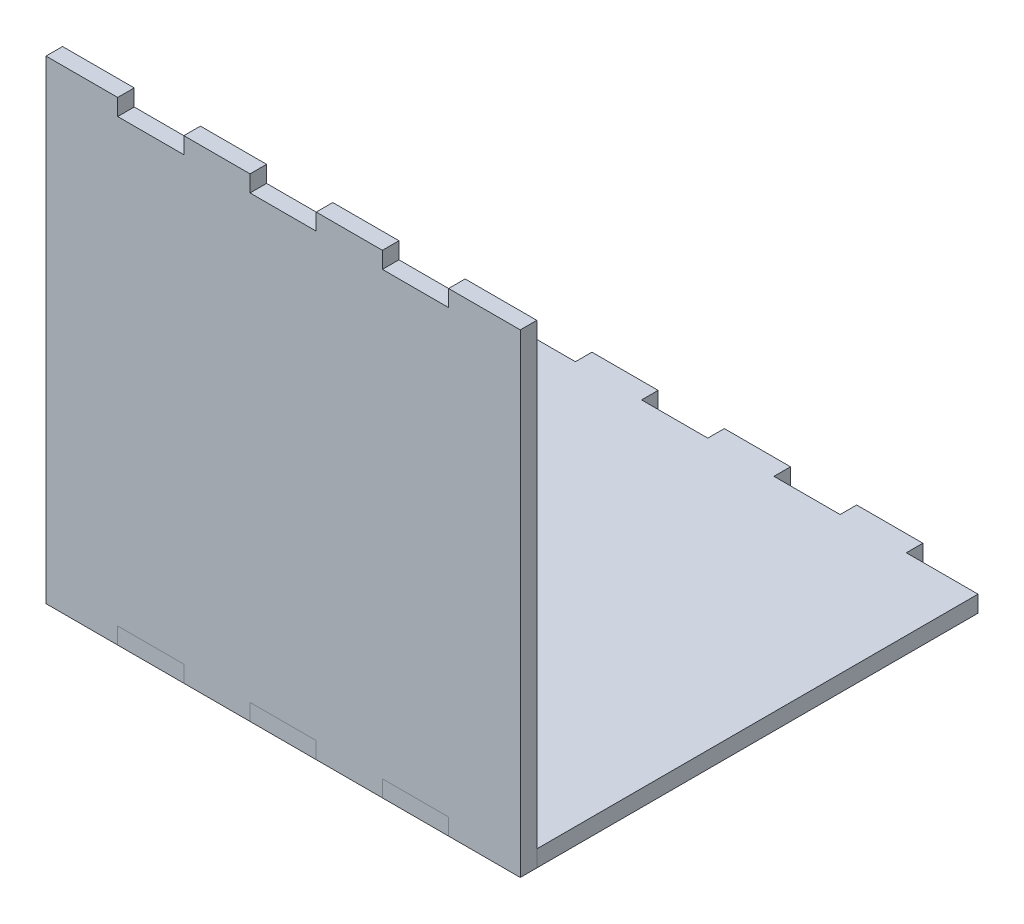
from build123d import *

# Parameters (mm, degrees)
SALIENTE_EXTRUIR1_DEPTH = 3
SALIENTE_EXTRUIR4_DEPTH = 3


with BuildPart() as part:
    # Croquis1 → Saliente-Extruir1 (new body)
    with BuildSketch(Plane.XY):
        Polygon((10, 0), (22, 0), (22, -3), (34, -3), (34, 0), (46, 0), (46, -3), (58, -3), (58, 0), (70, 0), (70, -3), (83, -3), (83, 83), (70, 83), (70, 80), (58, 80), (58, 83), (46, 83), (46, 80), (34, 80), (34, 83), (22, 83), (22, 80), (10, 80), (10, 83), (-3, 83), (-3, -3), (10, -3), align=None)
    extrude(amount=SALIENTE_EXTRUIR1_DEPTH)


with BuildPart() as body_2:
    # Croquis4 → Saliente-Extruir4 (new body)
    with BuildSketch(Plane(origin=(0, 0, 0), x_dir=(1, 0, 0), z_dir=(0, 1, 0))):
        Polygon((-3, 0), (-3, 80), (0, 80), (10, 80), (10, 83), (22, 83), (22, 80), (34, 80), (34, 83), (46, 83), (46, 80), (58, 80), (58, 83), (70, 83), (70, 80), (80, 80), (83, 80), (83, 0), (80, 0), (70, 0), (70, -3), (58, -3), (58, 0), (46, 0), (46, -3), (34, -3), (34, 0), (22, 0), (22, -3), (10, -3), (10, 0), (0, 0), align=None)
    extrude(amount=-SALIENTE_EXTRUIR4_DEPTH)


solid = Compound([part.part, body_2.part])
